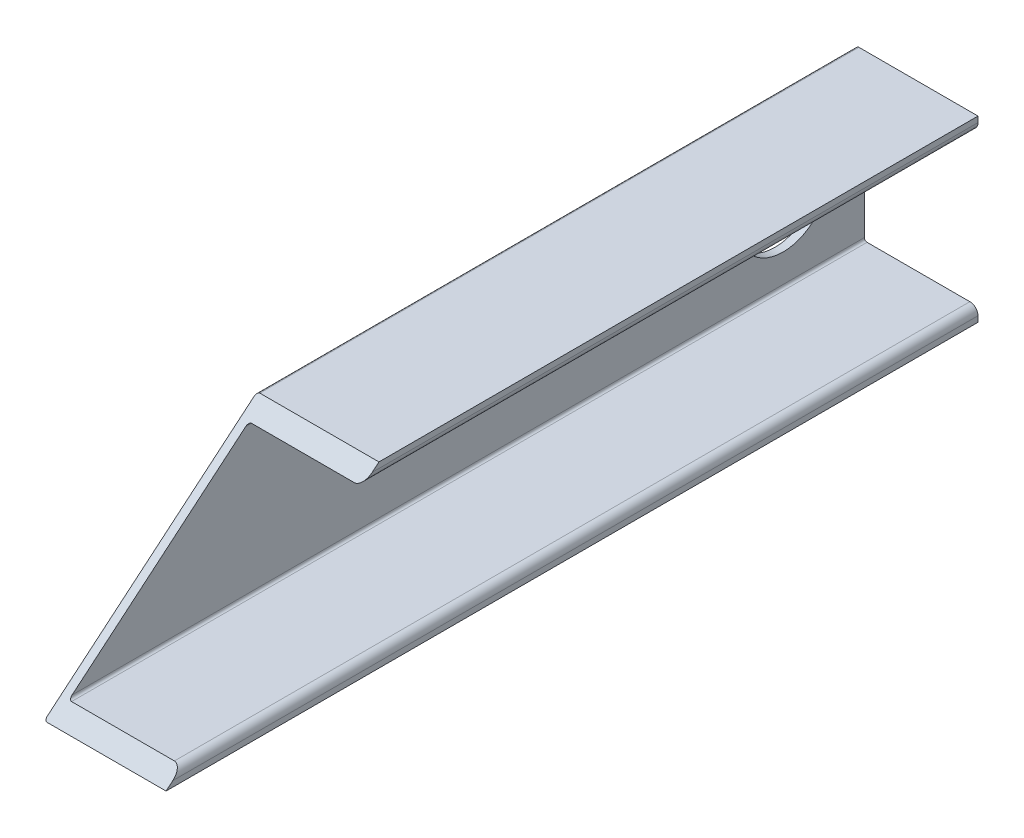
from build123d import *

# Parameters (mm, degrees)
BOSS_EXTRUDE1_DEPTH = 300
CUT_EXTRUDE1_REACH  = 307.146
FILLET1_R           = 3
FILLET2_R           = 1
SKETCH7_R           = 16.5
CUT_EXTRUDE4_DEPTH  = 50


with BuildPart() as part:
    # Sketch1 → Boss-Extrude1 (new body)
    with BuildSketch(Plane.XY):
        Polygon((0, 33), (0, -33), (45, -33), (45, -27.9), (3, -27.9), (3, 27.9), (45, 27.9), (45, 33), align=None)
    extrude(amount=BOSS_EXTRUDE1_DEPTH)

    # Sketch3 → Cut-Extrude1 (cut, up to next)
    with BuildSketch(Plane.ZY, mode=Mode.PRIVATE) as cut_extrude1_sk1:
        Polygon((300, -33), (221.344262889, 33), (300, 33), align=None)
    cut_extrude1_tool1 = extrude(cut_extrude1_sk1.sketch, amount=-CUT_EXTRUDE1_REACH, mode=Mode.PRIVATE) & part.part
    add(cut_extrude1_tool1.solids().sort_by_distance((0, 11, 273.781421))[0], mode=Mode.SUBTRACT)

    # Fillet1
    fillet1_edges = [part.edges().sort_by_distance(p)[0] for p in [
        (45, -27.9, 146.961028339),
        (45, 27.9, 113.711103106),
    ]]
    fillet(fillet1_edges, radius=FILLET1_R)

    # Fillet2
    fillet2_edges = [part.edges().sort_by_distance(p)[0] for p in [
        (0, -33, 150),
        (3, -27.9, 146.961028339),
        (0, 33, 110.672131444),
        (3, 27.9, 113.711103106),
    ]]
    fillet(fillet2_edges, radius=FILLET2_R)

    # Sketch7 → Cut-Extrude4 (cut)
    with BuildSketch(Plane.ZY):
        with Locations(Location((30, 0, 0), (0, 0, 270))):
            Circle(SKETCH7_R)
    extrude(amount=-CUT_EXTRUDE4_DEPTH, mode=Mode.SUBTRACT)


solid = part.part
